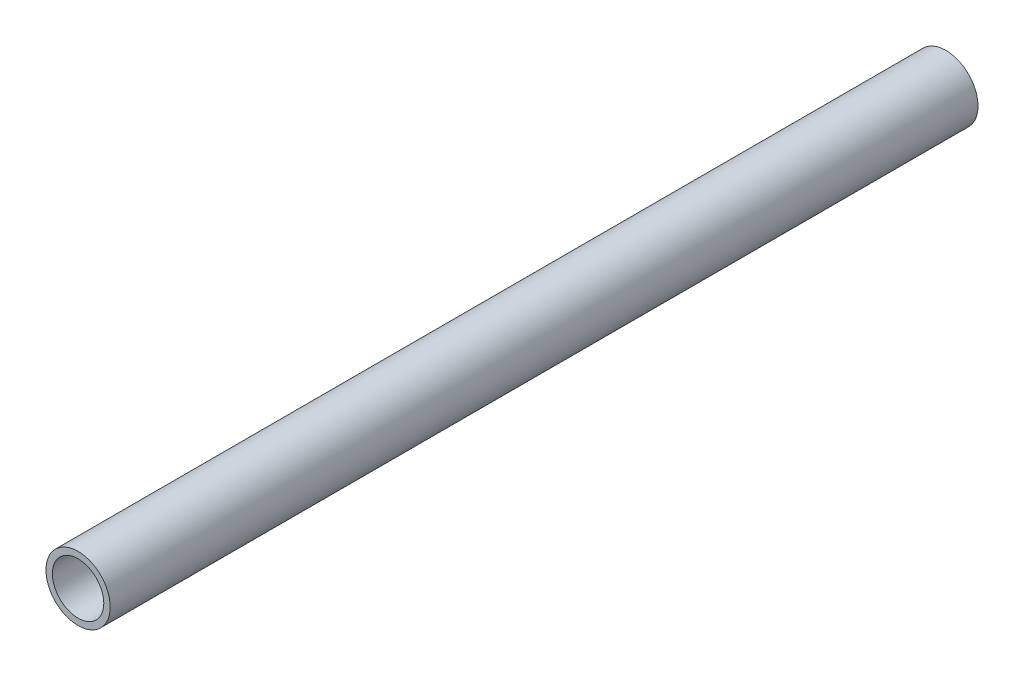
from build123d import *

# Parameters (mm, degrees)
SKETCH1_R           = 10
SKETCH1_R_2         = 8
EXTRUDE_THIN1_DEPTH = 270


with BuildPart() as part:
    # Sketch1 → Extrude-Thin1 (new body)
    with BuildSketch(Plane.XY):
        Circle(SKETCH1_R)
        Circle(SKETCH1_R_2, mode=Mode.SUBTRACT)
    extrude(amount=EXTRUDE_THIN1_DEPTH)


solid = part.part
